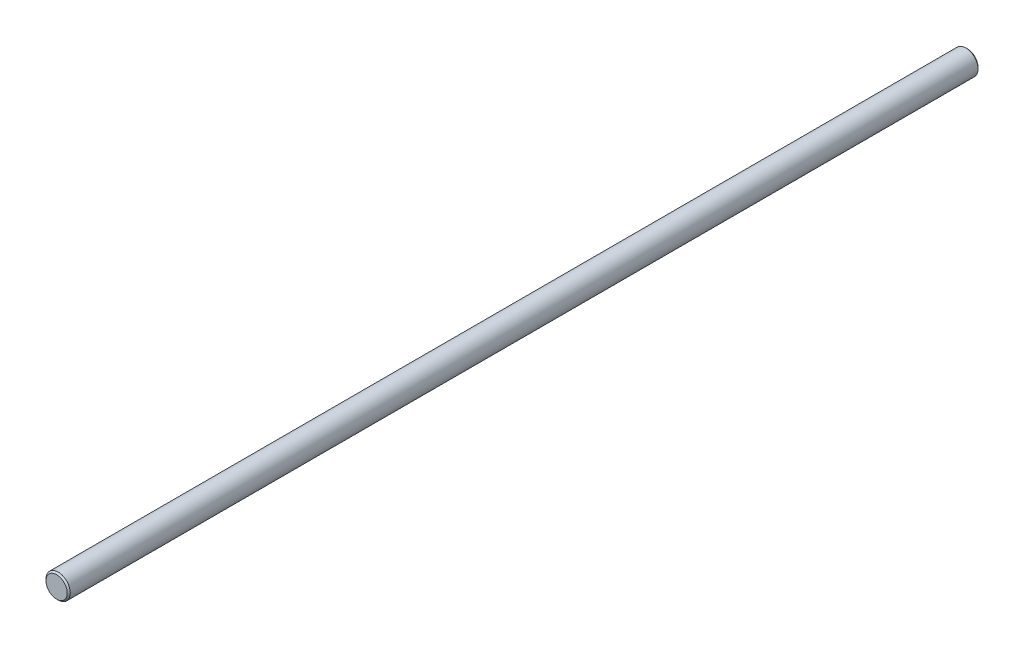
from build123d import *

# Parameters (mm, degrees)
SKETCH1_R           = 4
BOSS_EXTRUDE1_DEPTH = 300
CHAMFER1_SIZE       = 0.5


with BuildPart() as part:
    # Sketch1 → Boss-Extrude1 (new body)
    with BuildSketch(Plane.XY):
        Circle(SKETCH1_R)
    extrude(amount=BOSS_EXTRUDE1_DEPTH)

    # Chamfer1
    chamfer1_edges = [part.edges().sort_by_distance(p)[0] for p in [
        (-4, 0, 0),
        (-4, 0, 300),
    ]]
    chamfer(chamfer1_edges, length=CHAMFER1_SIZE)


solid = part.part
